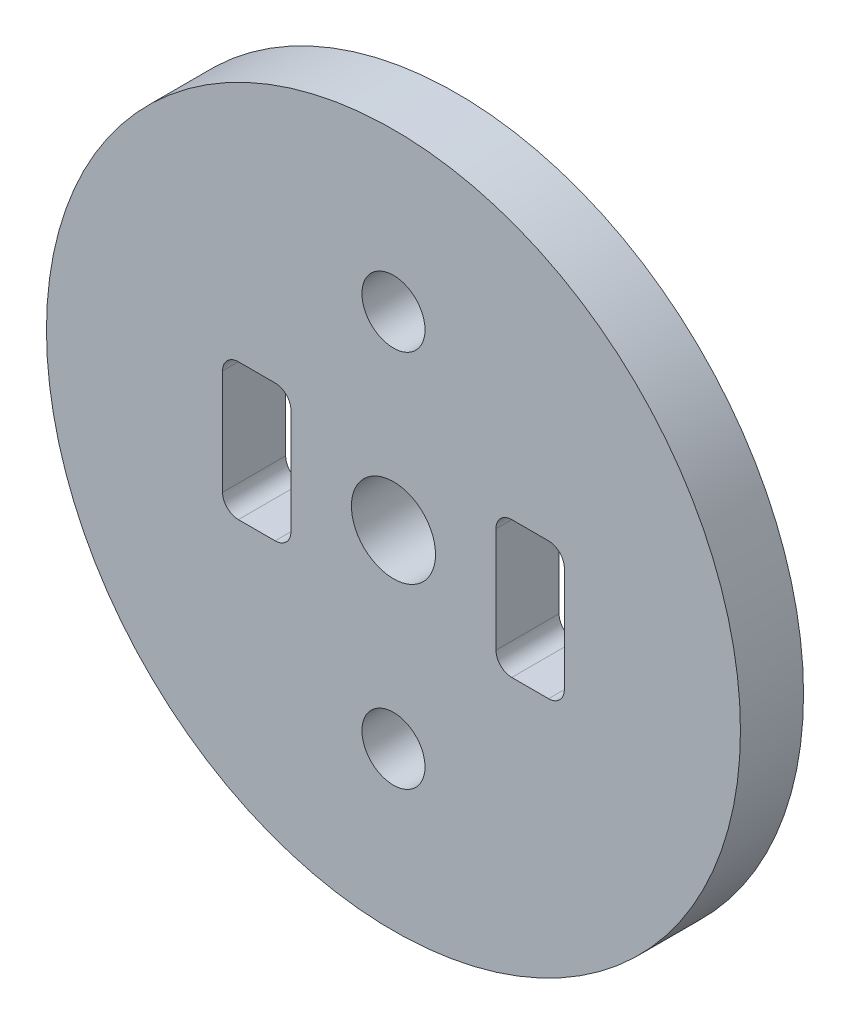
from build123d import *

# Parameters (mm, degrees)
MODEL_R                 = 16.5
MODEL_R_2               = 2
MODEL_R_3               = 1.5
SALIENTE_EXTRUIR1_DEPTH = 3


with BuildPart() as part:
    # Model → Saliente-Extruir1 (new body)
    with BuildSketch(Plane.XY):
        with Locations((215.747807914, 241.952019993)):
            Circle(MODEL_R)
        with Locations((215.747807914, 241.952019993)):
            Circle(MODEL_R_2, mode=Mode.SUBTRACT)
        with Locations((215.747807914, 232.952019993)):
            Circle(MODEL_R_3, mode=Mode.SUBTRACT)
        with Locations((215.747807914, 250.952019993)):
            Circle(MODEL_R_3, mode=Mode.SUBTRACT)
        with BuildLine():
            Line((223.122807913, 245.202019993), (221.372807913, 245.202019993))
            ThreePointArc((221.372807913, 245.202019993), (220.842477828, 244.982350079), (220.622807913, 244.452019993))
            Line((220.622807913, 244.452019993), (220.622807913, 239.452019993))
            ThreePointArc((220.622807913, 239.452019993), (220.842477828, 238.921689907), (221.372807913, 238.702019993))
            Line((221.372807913, 238.702019993), (223.122807913, 238.702019993))
            ThreePointArc((223.122807913, 238.702019993), (223.653137999, 238.921689907), (223.872807913, 239.452019993))
            Line((223.872807913, 239.452019993), (223.872807913, 244.452019993))
            ThreePointArc((223.872807913, 244.452019993), (223.653137999, 244.982350079), (223.122807913, 245.202019993))
        make_face(mode=Mode.SUBTRACT)
        with BuildLine():
            Line((208.372807913, 245.202019993), (210.122807913, 245.202019993))
            ThreePointArc((210.122807913, 245.202019993), (210.653137999, 244.982350079), (210.872807913, 244.452019993))
            Line((210.872807913, 244.452019993), (210.872807913, 239.452019993))
            ThreePointArc((210.872807913, 239.452019993), (210.653137999, 238.921689907), (210.122807913, 238.702019993))
            Line((210.122807913, 238.702019993), (208.372807913, 238.702019993))
            ThreePointArc((208.372807913, 238.702019993), (207.842477828, 238.921689907), (207.622807913, 239.452019993))
            Line((207.622807913, 239.452019993), (207.622807913, 244.452019993))
            ThreePointArc((207.622807913, 244.452019993), (207.842477828, 244.982350079), (208.372807913, 245.202019993))
        make_face(mode=Mode.SUBTRACT)
    extrude(amount=SALIENTE_EXTRUIR1_DEPTH)


solid = part.part
